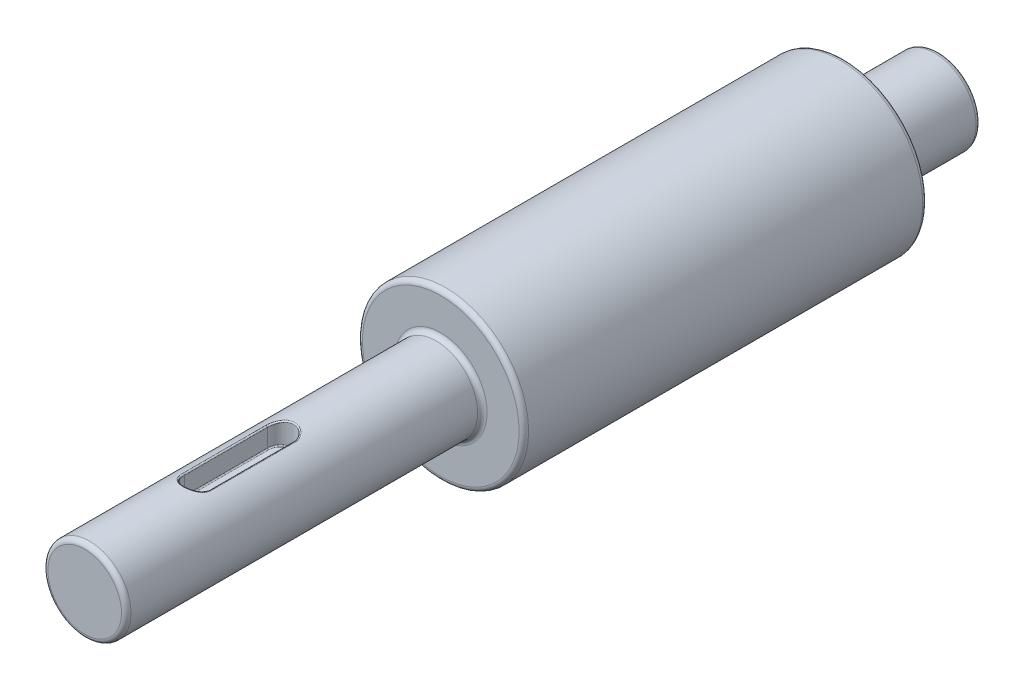
from build123d import *

# Parameters (mm, degrees)
SKETCH1_R               = 35
BOSS_EXTRUDE1_DEPTH     = 85
SKETCH2_R               = 17.5
BOSS_EXTRUDE2_DEPTH     = 150
BOSS_EXTRUDE3_START     = 40
SKETCH3_R               = 17.5
BOSS_EXTRUDE3_DEPTH     = 40
FILLET1_R               = 2
CUT_EXTRUDE1_REACH      = 243.452
CUT_EXTRUDE1_END_RADIUS = 17.5
FILLET2_R               = 0.5


with BuildPart() as part:
    # Sketch1 → Boss-Extrude1 (new, symmetric)
    with BuildSketch(Plane.XY):
        Circle(SKETCH1_R)
    extrude(amount=BOSS_EXTRUDE1_DEPTH, both=True)

    # Sketch2 → Boss-Extrude2 (add)
    with BuildSketch(Plane.XY.offset(85)):
        Circle(SKETCH2_R)
    extrude(amount=BOSS_EXTRUDE2_DEPTH)

    # Sketch3 → Boss-Extrude3 (add)
    with BuildSketch(Plane(origin=(0, 0, -85), x_dir=(-1, 0, 0), z_dir=(0, 0, -1)).offset(BOSS_EXTRUDE3_START)):
        with Locations(Location((0, 0, 0), (0, 0, 180))):
            Circle(SKETCH3_R)
    extrude(amount=-BOSS_EXTRUDE3_DEPTH)

    # Fillet1
    fillet1_edges = [part.edges().sort_by_distance(p)[0] for p in [
        (-17.5, 0, -125),
        (-35, 0, -85),
        (-35, 0, 85),
        (-17.5, 0, 85),
        (-17.5, 0, 235),
    ]]
    fillet(fillet1_edges, radius=FILLET1_R)

    # Cut-Extrude1: up to this cylinder (the profile starts inside it)
    cut_extrude1_end = Plane(origin=(0, 0, 170), z_dir=(0, 0, -1)) * Cylinder(CUT_EXTRUDE1_END_RADIUS, 522.904, mode=Mode.PRIVATE)
    # Sketch4 → Cut-Extrude1 (cut, up to the surface)
    with BuildSketch(Plane(origin=(0, 8, 0), x_dir=(1, 0, 0), z_dir=(0, 1, 0)), mode=Mode.PRIVATE) as cut_extrude1_sk1:
        with BuildLine():
            Line((-5.5, -187.5), (-5.5, -152.5))
            ThreePointArc((-5.5, -152.5), (0, -147), (5.5, -152.5))
            Line((5.5, -152.5), (5.5, -187.5))
            ThreePointArc((5.5, -187.5), (0, -193), (-5.5, -187.5))
        make_face()
    cut_extrude1_tool1 = extrude(cut_extrude1_sk1.sketch, amount=CUT_EXTRUDE1_REACH, mode=Mode.PRIVATE) & cut_extrude1_end
    add(cut_extrude1_tool1.solids().sort_by_distance((0, 8, 170))[0], mode=Mode.SUBTRACT)

    # Fillet2
    fillet2_edges = [part.edges().sort_by_distance(p)[0] for p in [
        (0, 17.500000003, 193.000000004),
        (0, 8, 193),
        (5.5, 16.613247726, 170),
        (5.5, 8, 170),
        (-2e-09, 17.499999972, 146.999999993),
        (0, 8, 147),
        (-5.5, 16.613247726, 170),
        (-5.5, 8, 170),
    ]]
    fillet(fillet2_edges, radius=FILLET2_R)


solid = part.part
